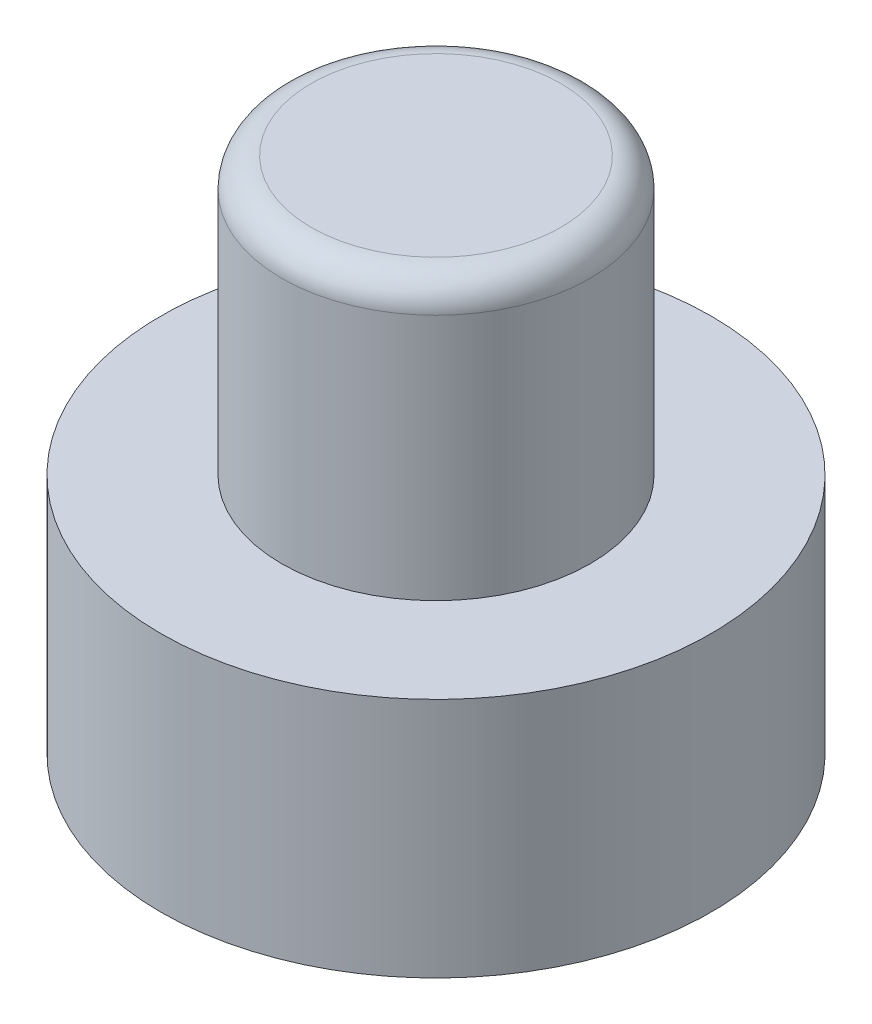
from build123d import *

# Parameters (mm, degrees)
SKETCH1_R           = 4.675
BOSS_EXTRUDE1_DEPTH = 4.1
SKETCH2_R           = 2.62
BOSS_EXTRUDE2_DEPTH = 4.7
FILLET1_R           = 0.5


with BuildPart() as part:
    # Sketch1 → Boss-Extrude1 (new body)
    with BuildSketch(Plane(origin=(0, 0, 0), x_dir=(1, 0, 0), z_dir=(0, 1, 0))):
        with Locations(Location((0, 0, 0), (0, 0, 270))):
            Circle(SKETCH1_R)
    extrude(amount=BOSS_EXTRUDE1_DEPTH)

    # Sketch2 → Boss-Extrude2 (add)
    with BuildSketch(Plane(origin=(0, 4.1, 0), x_dir=(1, 0, 0), z_dir=(0, 1, 0))):
        with Locations(Location((0, 0, 0), (0, 0, 270))):
            Circle(SKETCH2_R)
    extrude(amount=BOSS_EXTRUDE2_DEPTH)

    # Fillet1
    fillet1_edges = [part.edges().sort_by_distance(p)[0] for p in [
        (0, 8.8, -2.62),
    ]]
    fillet(fillet1_edges, radius=FILLET1_R)


solid = part.part
